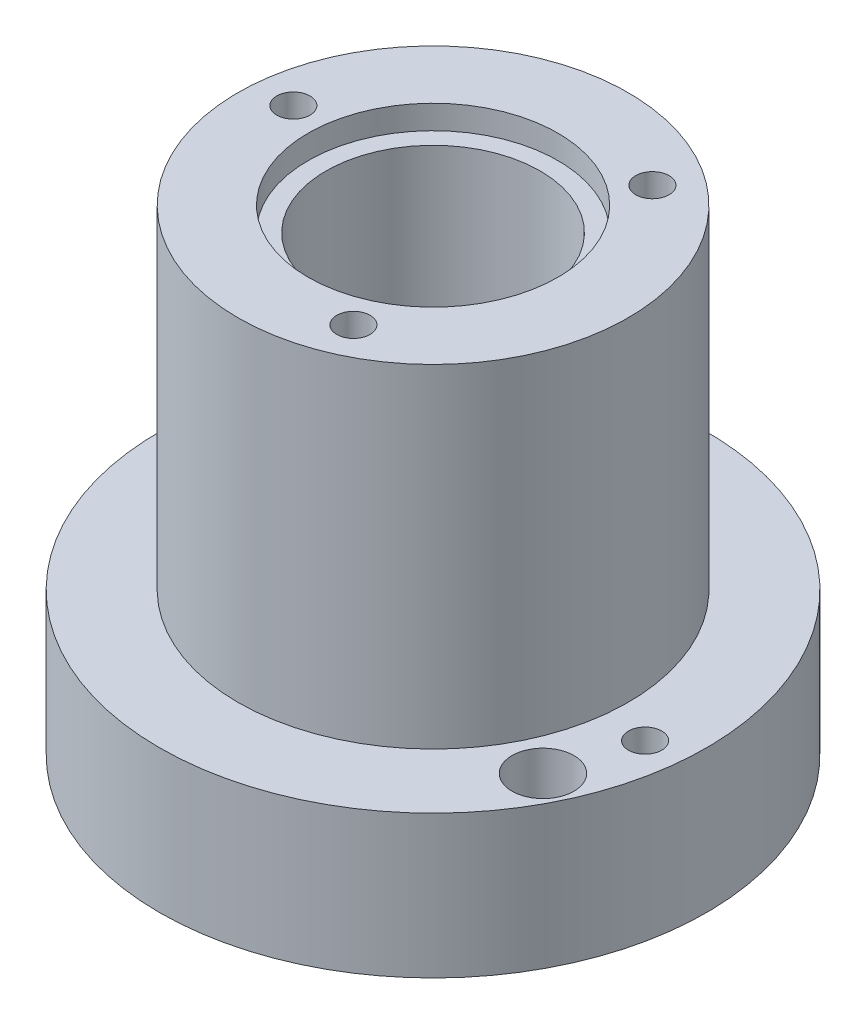
from build123d import *

# Parameters (mm, degrees)
SKETCH1_R                     = 14.605
BOSS_EXTRUDE2_DEPTH           = 25.4
SKETCH10_R                    = 5.715
CUT_EXTRUDE5_DEPTH            = 48.424233935
SKETCH11_R                    = 6.6675
CUT_EXTRUDE6_DEPTH            = 1.27
SKETCH12_OUTSIDE_W            = 40.908
SKETCH12_OUTSIDE_H            = 40.908
SKETCH12_OUTSIDE_R            = 10.414
CUT_EXTRUDE7_DEPTH            = 17.78
CIRPATTERN1_COUNT             = 3
CIRPATTERN2_COUNT             = 2
SKETCH26_R                    = 1.651
CUT_EXTRUDE8_DEPTH            = 8.89
CIRPATTERN3_COUNT             = 2
SKETCH27_R                    = 0.79375
CUT_EXTRUDE9_DEPTH            = 24.13
TAP_DRILL_FOR_0_80_TAP3_D     = 1.19126
TAP_DRILL_FOR_0_80_TAP3_DEPTH = 6.35
TAP_DRILL_FOR_0_80_TAP3_TIP   = 0.499792913
TAP_DRILL_FOR_2_56_TAP1_D     = 1.778
CIRPATTERN4_COUNT             = 2


with BuildPart() as part:
    # Sketch1 → Boss-Extrude2 (new body)
    with BuildSketch(Plane(origin=(0, 0, 0), x_dir=(1, 0, 0), z_dir=(0, 1, 0))):
        with Locations(Location((13.028153923, -14.383045271, 0), (0, 0, 270))):
            Circle(SKETCH1_R)
    extrude(amount=BOSS_EXTRUDE2_DEPTH)

    # Sketch10 → Cut-Extrude5 (cut, through all)
    with BuildSketch(Plane(origin=(0, 25.4, 0), x_dir=(1, 0, 0), z_dir=(0, 1, 0))):
        with Locations(Location((13.028153923, -14.383045271, 0), (0, 0, 270))):
            Circle(SKETCH10_R)
    extrude(amount=-CUT_EXTRUDE5_DEPTH, mode=Mode.SUBTRACT)

    # Sketch11 → Cut-Extrude6 (cut)
    with BuildSketch(Plane(origin=(0, 25.4, 0), x_dir=(1, 0, 0), z_dir=(0, 1, 0))):
        with Locations(Location((13.028153923, -14.383045271, 0), (0, 0, 270))):
            Circle(SKETCH11_R)
    extrude(amount=-CUT_EXTRUDE6_DEPTH, mode=Mode.SUBTRACT)

    # Sketch12 outside → Cut-Extrude7 (cut)
    with BuildSketch(Plane(origin=(0, 25.4, 0), x_dir=(1, 0, 0), z_dir=(0, 1, 0))):
        with Locations((13.028, -14.383)):
            Rectangle(SKETCH12_OUTSIDE_W, SKETCH12_OUTSIDE_H)
        with Locations(Location((13.028153923, -14.383045271, 0), (0, 0, 270))):
            Circle(SKETCH12_OUTSIDE_R, mode=Mode.SUBTRACT)
    extrude(amount=-CUT_EXTRUDE7_DEPTH, mode=Mode.SUBTRACT)

    # Sketch17 → #50 (0.07) Diameter Hole1 (revolve, cut)
    with BuildSketch(Plane(origin=(4.692367215, 25.4, 13.504077717), x_dir=(0, 0, 1), z_dir=(1, 0, 0))):
        Polygon((0, 0), (0, 3.07416509), (0.889, 2.54), (0.889, 0), align=None)
    f_50_0_07_diameter_hole1 = revolve(axis=Axis((4.692367215, 31.75, 13.504077717), (0, -1, 0)), mode=Mode.SUBTRACT)

    # CirPattern1: #50 (0.07) Diameter Hole1 ×3 about axis
    cirpattern1_axis = Axis((13.028153923, 0, 14.383045271), (0, 1, 0))
    for i in range(1, CIRPATTERN1_COUNT):
        add(f_50_0_07_diameter_hole1.rotate(cirpattern1_axis, i * 360 / CIRPATTERN1_COUNT), mode=Mode.SUBTRACT)

    # Sketch24 → Tap Drill for #6-32 Tap1 (revolve, cut)
    with BuildSketch(Plane(origin=(8.163266455, 0, 24.388191195), x_dir=(0, 0, -1), z_dir=(1, 0, 0))):
        Polygon((0, 0), (0, 4.81319403), (1.35255, 4.0005), (1.35255, 0), align=None)
    tap_drill_for_6_32_tap1 = revolve(axis=Axis((8.163266455, -6.35, 24.388191195), (0, 1, 0)), mode=Mode.SUBTRACT)

    # CirPattern2: Tap Drill for #6-32 Tap1 ×2 about axis
    cirpattern2_axis = Axis((13.028153923, 0, 14.383045271), (0, 1, 0))
    for i in range(1, CIRPATTERN2_COUNT):
        add(tap_drill_for_6_32_tap1.rotate(cirpattern2_axis, i * 360 / CIRPATTERN2_COUNT), mode=Mode.SUBTRACT)

    # Sketch26 → Cut-Extrude8 (cut)
    with BuildSketch(Plane(origin=(0, 0, 0), x_dir=(-1, 0, 0), z_dir=(0, -1, 0))):
        with Locations(Location((-1.606754466, -8.829520764, 0), (0, 0, 90))):
            Circle(SKETCH26_R)
    cut_extrude8 = extrude(amount=-CUT_EXTRUDE8_DEPTH, mode=Mode.SUBTRACT)

    # CirPattern3: Cut-Extrude8 ×2 about axis
    cirpattern3_axis = Axis((13.028153923, 0, 14.383045271), (0, 1, 0))
    for i in range(1, CIRPATTERN3_COUNT):
        add(cut_extrude8.rotate(cirpattern3_axis, i * 360 / CIRPATTERN3_COUNT), mode=Mode.SUBTRACT)

    # Sketch27 → Cut-Extrude9 (cut)
    with BuildSketch(Plane(origin=(0, 0, 0), x_dir=(-1, 0, 0), z_dir=(0, -1, 0))):
        with Locations(Location((-5.827402564, -17.142659866, 0), (0, 0, 90))):
            Circle(SKETCH27_R)
    extrude(amount=-CUT_EXTRUDE9_DEPTH, mode=Mode.SUBTRACT)

    # Tap Drill for #0-80 Tap3
    with Locations(Plane(origin=(0, 0, 0), x_dir=(-1, 0, 0), z_dir=(0, -1, 0))):
        with Locations((-5.827402564, -15.237659866), (-5.827402564, -19.047659866)):
            Hole(TAP_DRILL_FOR_0_80_TAP3_D / 2, depth=TAP_DRILL_FOR_0_80_TAP3_DEPTH)
            with Locations((0, 0, -(TAP_DRILL_FOR_0_80_TAP3_DEPTH + TAP_DRILL_FOR_0_80_TAP3_TIP / 2))):  # 100° drill point
                Cone(0, TAP_DRILL_FOR_0_80_TAP3_D / 2, TAP_DRILL_FOR_0_80_TAP3_TIP, mode=Mode.SUBTRACT)

    # Tap Drill for #2-56 Tap1 (through all)
    with Locations(Plane(origin=(0.396131886, 0, 13.070787952), x_dir=(0, 0, -1), z_dir=(0, -1, 0))):
        with Locations((0, 0)):
            tap_drill_for_2_56_tap1 = Hole(TAP_DRILL_FOR_2_56_TAP1_D / 2)

    # CirPattern4: Tap Drill for #2-56 Tap1 ×2 about axis
    cirpattern4_axis = Axis((13.028153923, 0, 14.383045271), (0, 1, 0))
    for i in range(1, CIRPATTERN4_COUNT):
        add(tap_drill_for_2_56_tap1.rotate(cirpattern4_axis, i * 360 / CIRPATTERN4_COUNT), mode=Mode.SUBTRACT)


solid = part.part
